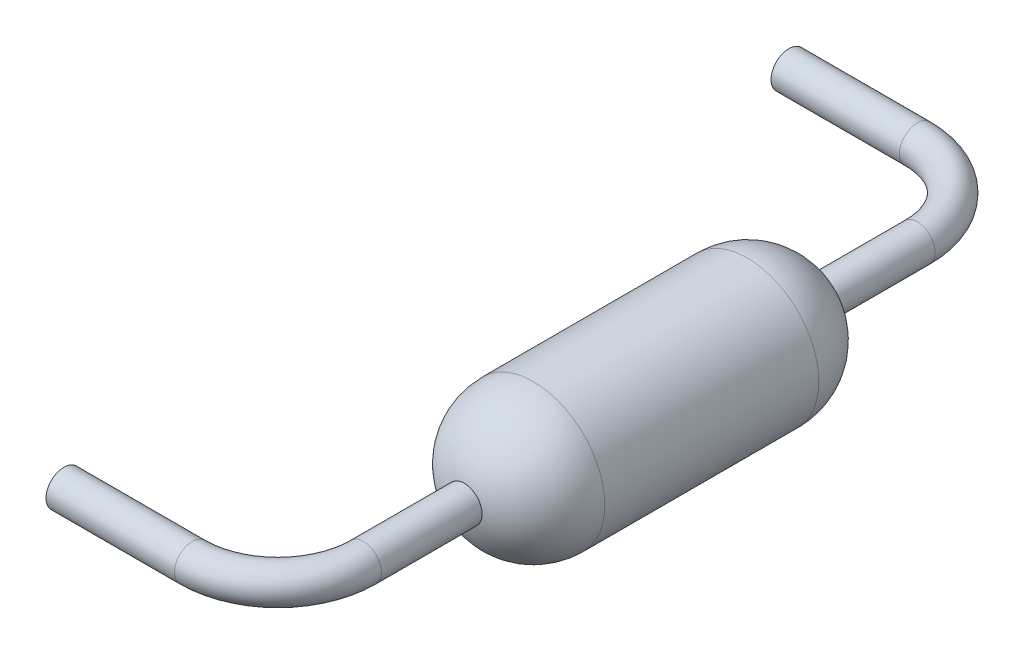
from build123d import *

# Parameters (mm, degrees)
SKETCH1_R           = 1
BOSS_EXTRUDE1_DEPTH = 1.5
DOME1_FACE_RADIUS   = 1
DOME1_HEIGHT        = 1
DOME2_FACE_RADIUS   = 1
DOME2_HEIGHT        = 1
SKETCH4_R           = 0.25


with BuildPart() as part:
    # Sketch1 → Boss-Extrude1 (new, symmetric)
    with BuildSketch(Plane.XY):
        Circle(SKETCH1_R)
    extrude(amount=BOSS_EXTRUDE1_DEPTH, both=True)

    # Dome1: a dome of height H over a round flat face of radius A is a cap of a sphere of radius (A * A + H * H) / (2 * H)
    dome1_r = (DOME1_FACE_RADIUS * DOME1_FACE_RADIUS + DOME1_HEIGHT * DOME1_HEIGHT) / (2 * DOME1_HEIGHT)
    dome1_base = Plane((0, 0, 1.5), z_dir=(0, 0, 1))
    with Locations(dome1_base.offset(DOME1_HEIGHT - dome1_r)):
        dome1_ball = Sphere(dome1_r, mode=Mode.PRIVATE)
    add(split(dome1_ball, bisect_by=dome1_base, keep=Keep.TOP, mode=Mode.PRIVATE))

    # Dome2: a dome of height H over a round flat face of radius A is a cap of a sphere of radius (A * A + H * H) / (2 * H)
    dome2_r = (DOME2_FACE_RADIUS * DOME2_FACE_RADIUS + DOME2_HEIGHT * DOME2_HEIGHT) / (2 * DOME2_HEIGHT)
    dome2_base = Plane((0, 0, -1.5), z_dir=(0, 0, -1))
    with Locations(dome2_base.offset(DOME2_HEIGHT - dome2_r)):
        dome2_ball = Sphere(dome2_r, mode=Mode.PRIVATE)
    add(split(dome2_ball, bisect_by=dome2_base, keep=Keep.TOP, mode=Mode.PRIVATE))

    # Sweep1: sweep along a path in Sketch3
    with BuildLine(Plane(origin=(0, 0, 0), x_dir=(1, 0, 0), z_dir=(0, 1, 0))) as sweep1_path:
        Line((-3, -5.08), (-1.2, -5.08))
        ThreePointArc((-1.2, -5.08), (-0.351471863, -4.728528137), (0, -3.88))
        Line((0, -3.88), (0, 3.88))
        ThreePointArc((0, 3.88), (-0.351471863, 4.728528137), (-1.2, 5.08))
        Line((-1.2, 5.08), (-3, 5.08))
    # Sketch4 → Sweep1 (sweep)
    with BuildSketch(Plane.XY):
        Circle(SKETCH4_R)
    sweep(path=sweep1_path.line)


solid = part.part
